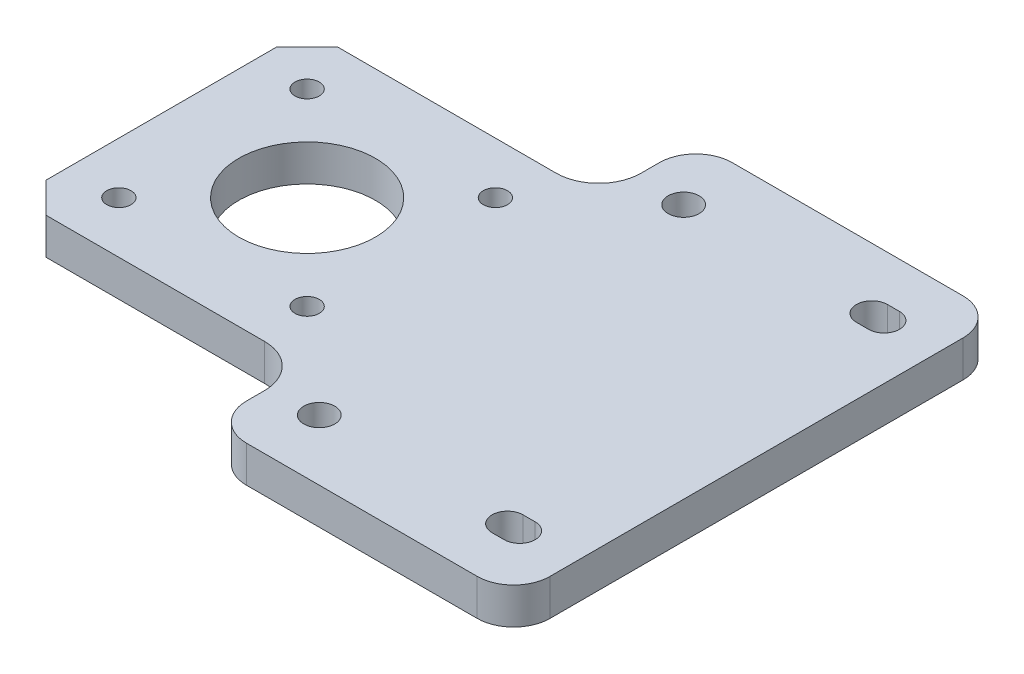
from build123d import *

# Parameters (mm, degrees)
SKETCH_1_R          = 11.25
SKETCH_1_R_2        = 2
EXTRUDE_1_DEPTH     = 6
SKETCH_2_R          = 2.55
CUT_EXTRUDE_1_DEPTH = 84.456575535


with BuildPart() as part:
    # Эскиз1 → Бобышка-Вытянуть1 (new body)
    with BuildSketch(Plane(origin=(0, 0, 0), x_dir=(1, 0, 0), z_dir=(0, 1, 0))):
        with BuildLine():
            Line((-32, -24), (-68, -24))
            Line((-68, -24), (-73, -19))
            Line((-73, -19), (-73, 19))
            Line((-73, 19), (-68, 24))
            Line((-68, 24), (-32, 24))
            ThreePointArc((-32, 24), (-27.050252532, 26.050252532), (-25, 31))
            Line((-25, 31), (-25, 34))
            ThreePointArc((-25, 34), (-23.242640687, 38.242640687), (-19, 40))
            Line((-19, 40), (19, 40))
            ThreePointArc((19, 40), (23.242640687, 38.242640687), (25, 34))
            Line((25, 34), (25, -34))
            ThreePointArc((25, -34), (23.242640687, -38.242640687), (19, -40))
            Line((19, -40), (-19, -40))
            ThreePointArc((-19, -40), (-23.242640687, -38.242640687), (-25, -34))
            Line((-25, -34), (-25, -31))
            ThreePointArc((-25, -31), (-27.050252532, -26.050252532), (-32, -24))
        make_face()
        with Locations(Location((-49, 0, 0), (0, 0, 270))):
            Circle(SKETCH_1_R, mode=Mode.SUBTRACT)
        with Locations(Location((-64.5, 15.5, 0), (0, 0, 270))):
            Circle(SKETCH_1_R_2, mode=Mode.SUBTRACT)
        with Locations(Location((-64.5, -15.5, 0), (0, 0, 90))):
            Circle(SKETCH_1_R_2, mode=Mode.SUBTRACT)
        with Locations(Location((-33.5, 15.5, 0), (0, 0, 90))):
            Circle(SKETCH_1_R_2, mode=Mode.SUBTRACT)
        with Locations(Location((-33.5, -15.5, 0), (0, 0, 270))):
            Circle(SKETCH_1_R_2, mode=Mode.SUBTRACT)
    extrude(amount=EXTRUDE_1_DEPTH)

    # Эскиз2 → Вырез-Вытянуть1 (cut, through all)
    with BuildSketch(Plane.XZ):
        with Locations(Location((-17, -30, 0), (0, 0, 270))):
            Circle(SKETCH_2_R)
        with Locations(Location((-17, 30, 0), (0, 0, 90))):
            Circle(SKETCH_2_R)
        with BuildLine():
            Line((16, -32.55), (14, -32.55))
            ThreePointArc((14, -32.55), (11.45, -30), (14, -27.45))
            Line((14, -27.45), (16, -27.45))
            ThreePointArc((16, -27.45), (18.55, -30), (16, -32.55))
        make_face()
        with BuildLine():
            Line((16, 32.55), (14, 32.55))
            ThreePointArc((14, 32.55), (11.45, 30), (14, 27.45))
            Line((14, 27.45), (16, 27.45))
            ThreePointArc((16, 27.45), (18.55, 30), (16, 32.55))
        make_face()
    extrude(amount=-CUT_EXTRUDE_1_DEPTH, mode=Mode.SUBTRACT)


solid = part.part
